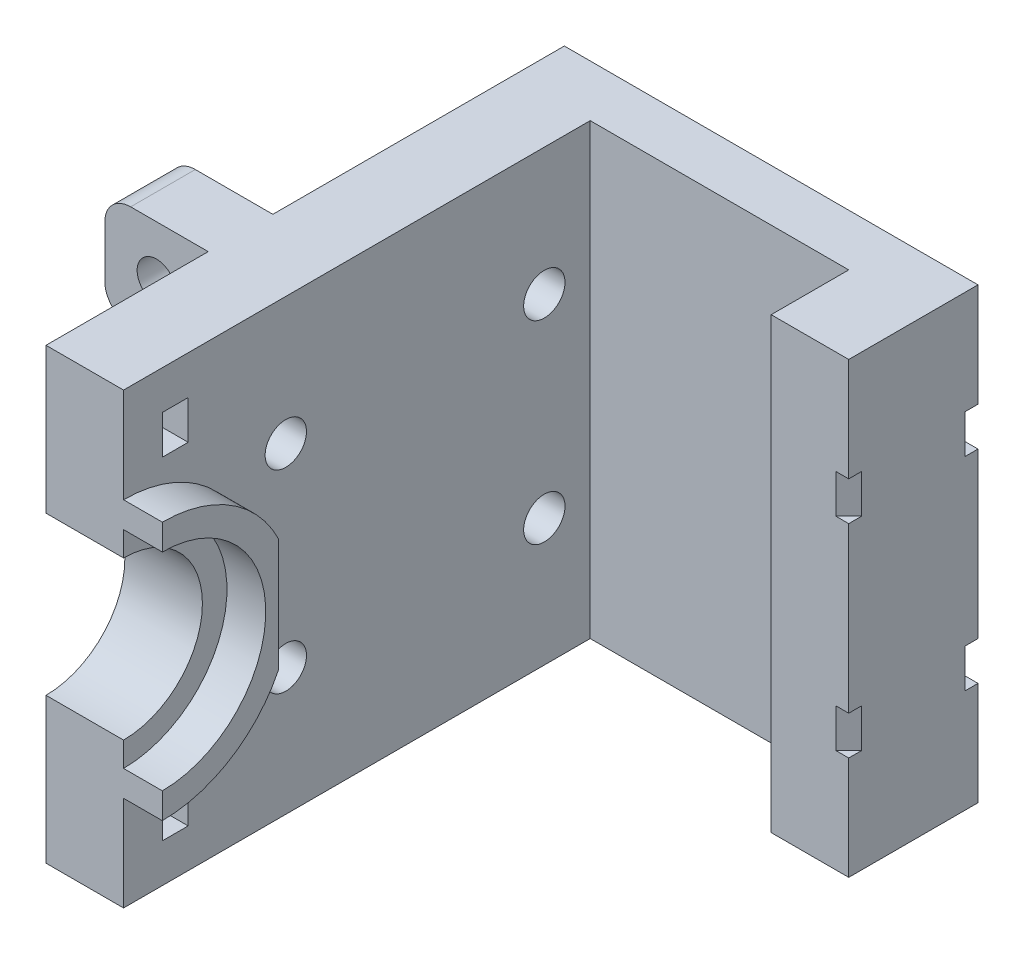
from build123d import *

# Parameters (mm, degrees)
SKETCH_2_W          = 2
SKETCH_2_H          = 3
SKETCH_2_R          = 1.6
EXTRUDE_1_DEPTH     = 6
EXTRUDE_2_DEPTH     = 3
SKETCH_4_W          = 4
SKETCH_4_H          = 34.7
EXTRUDE_3_DEPTH     = 26
SKETCH_15_W         = 10
SKETCH_15_H         = 34.7
EXTRUDE_8_DEPTH     = 6
SKETCH_16_W         = 2
SKETCH_16_H         = 3
CUT_EXTRUDE_4_DEPTH = 6
CUT_EXTRUDE_5_DEPTH = 3
CUT_EXTRUDE_6_DEPTH = 3
SKETCH_20_W         = 8
SKETCH_20_H         = 5
EXTRUDE_9_DEPTH     = 40
SKETCH_22_R         = 1.5
CUT_EXTRUDE_7_DEPTH = 10
SKETCH_23_W         = 8
SKETCH_23_H         = 24
CUT_EXTRUDE_8_DEPTH = 10
FILLET_4_R          = 5
FILLET_5_R          = 2
FILLET_6_R          = 2
FILLET_7_R          = 2


with BuildPart() as part:
    # 草圖2 → 填料-伸長1 (new body)
    with BuildSketch(Plane(origin=(0, 0, 0), x_dir=(0, 0, -1), z_dir=(1, 0, 0))):
        with BuildLine():
            Line((13.55, 17.35), (-13.55, 17.35))
            Line((-13.55, 17.35), (-22.55, 17.35))
            Line((-22.55, 17.35), (-22.55, 6.1))
            ThreePointArc((-22.55, 6.1), (-16.45, 0), (-22.55, -6.1))
            Line((-22.55, -6.1), (-22.55, -17.35))
            Line((-22.55, -17.35), (-13.55, -17.35))
            Line((-13.55, -17.35), (13.55, -17.35))
            Line((13.55, -17.35), (13.55, 17.35))
        make_face()
        with Locations((-18.55, -12.85)):
            Rectangle(SKETCH_2_W, SKETCH_2_H, mode=Mode.SUBTRACT)
        with Locations((-10, -7.5)):
            Circle(SKETCH_2_R, mode=Mode.SUBTRACT)
        with Locations((10, -7.5)):
            Circle(SKETCH_2_R, mode=Mode.SUBTRACT)
        with Locations((-10, 7.5)):
            Circle(SKETCH_2_R, mode=Mode.SUBTRACT)
        with Locations((-18.55, 12.85)):
            Rectangle(SKETCH_2_W, SKETCH_2_H, mode=Mode.SUBTRACT)
        with Locations((10, 7.5)):
            Circle(SKETCH_2_R, mode=Mode.SUBTRACT)
    extrude(amount=EXTRUDE_1_DEPTH)

    # 草圖3 → 填料-伸長2 (add)
    with BuildSketch(Plane(origin=(6, 0, 0), x_dir=(0, 0, -1), z_dir=(1, 0, 0))):
        with BuildLine():
            Line((-13.55, 4.358898944), (-13.55, -4.358898944))
            ThreePointArc((-13.55, -4.358898944), (-17.239114454, -8.473163206), (-22.55, -10))
            Line((-22.55, -10), (-22.55, -8))
            ThreePointArc((-22.55, -8), (-14.55, 0), (-22.55, 8))
            Line((-22.55, 8), (-22.55, 10))
            ThreePointArc((-22.55, 10), (-17.239114454, 8.473163206), (-13.55, 4.358898944))
        make_face()
    extrude(amount=EXTRUDE_2_DEPTH)

    # 草圖4 → 填料-伸長3 (add)
    with BuildSketch(Plane.ZY):
        with Locations((-15.55, 0)):
            Rectangle(SKETCH_4_W, SKETCH_4_H)
    extrude(amount=-EXTRUDE_3_DEPTH)

    # 草圖15 → 填料-伸長8 (add)
    with BuildSketch(Plane(origin=(26, 0, 0), x_dir=(0, 0, -1), z_dir=(1, 0, 0))):
        with Locations((12.55, 0)):
            Rectangle(SKETCH_15_W, SKETCH_15_H)
    extrude(amount=EXTRUDE_8_DEPTH)

    # 草圖16 → 除料-伸長4 (cut)
    with BuildSketch(Plane(origin=(0, 0, -17.55), x_dir=(-1, 0, 0), z_dir=(0, 0, -1))):
        with Locations((-25, 7.85)):
            Rectangle(SKETCH_16_W, SKETCH_16_H)
        with Locations((-25, -7.85)):
            Rectangle(SKETCH_16_W, SKETCH_16_H)
    extrude(amount=-CUT_EXTRUDE_4_DEPTH, mode=Mode.SUBTRACT)

    # 草圖17 → 除料-伸長5 (cut)
    with BuildSketch(Plane(origin=(0, -9.35, 0), x_dir=(-1, 0, 0), z_dir=(0, -1, 0))):
        Polygon((-32, 17.55), (-31, 17.55), (-32, 16.55), align=None)
        Polygon((-32, 7.55), (-32, 8.55), (-31, 7.55), align=None)
    extrude(amount=-CUT_EXTRUDE_5_DEPTH, mode=Mode.SUBTRACT)

    # 草圖18 → 除料-伸長6 (cut)
    with BuildSketch(Plane(origin=(0, 9.35, 0), x_dir=(1, 0, 0), z_dir=(0, 1, 0))):
        Polygon((32, 17.55), (31, 17.55), (32, 16.55), align=None)
        Polygon((32, 7.55), (32, 8.55), (31, 7.55), align=None)
    extrude(amount=-CUT_EXTRUDE_6_DEPTH, mode=Mode.SUBTRACT)

    # 草圖20 → 填料-伸長9 (add)
    with BuildSketch(Plane(origin=(0, 17.35, 0), x_dir=(1, 0, 0), z_dir=(0, 1, 0))):
        with Locations((-4, -7.5)):
            Rectangle(SKETCH_20_W, SKETCH_20_H)
    extrude(amount=-EXTRUDE_9_DEPTH)

    # 草圖22 → 除料-伸長7 (cut)
    with BuildSketch(Plane.XY.offset(10)):
        with Locations((-4, 13.35)):
            Circle(SKETCH_22_R)
        with Locations((-4, -18.65)):
            Circle(SKETCH_22_R)
    extrude(amount=-CUT_EXTRUDE_7_DEPTH, mode=Mode.SUBTRACT)

    # 草圖23 → 除料-伸長8 (cut)
    with BuildSketch(Plane.XY.offset(10)):
        with Locations((-4, -2.65)):
            Rectangle(SKETCH_23_W, SKETCH_23_H)
    extrude(amount=-CUT_EXTRUDE_8_DEPTH, mode=Mode.SUBTRACT)

    # 圓角4
    fillet_4_edges = [part.edges().sort_by_distance(p)[0] for p in [
        (0, -14.65, 7.5),
    ]]
    fillet(fillet_4_edges, radius=FILLET_4_R)

    # 圓角5
    fillet_5_edges = [part.edges().sort_by_distance(p)[0] for p in [
        (0, -17.35, 7.5),
    ]]
    fillet(fillet_5_edges, radius=FILLET_5_R)

    # 圓角6
    fillet_6_edges = [part.edges().sort_by_distance(p)[0] for p in [
        (-8, -22.65, 7.5),
        (-8, 17.35, 7.5),
        (-8, -14.65, 7.5),
        (-8, 9.35, 7.5),
    ]]
    fillet(fillet_6_edges, radius=FILLET_6_R)

    # 圓角7
    fillet_7_edges = [part.edges().sort_by_distance(p)[0] for p in [
        (0, -22.65, 7.5),
    ]]
    fillet(fillet_7_edges, radius=FILLET_7_R)


solid = part.part
